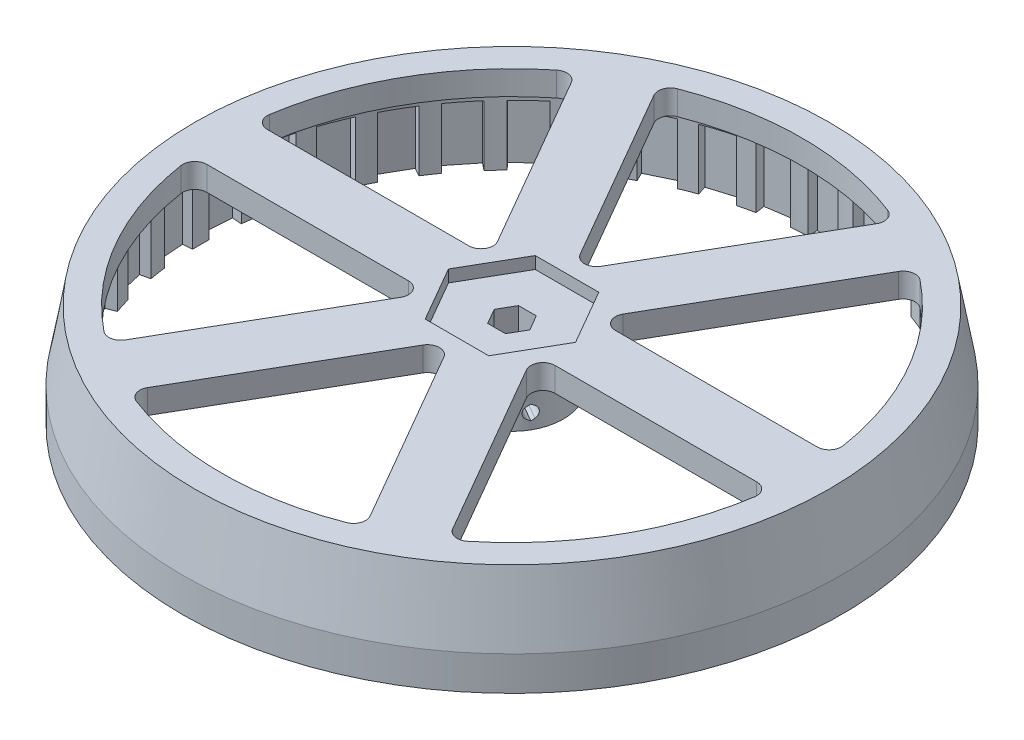
from build123d import *

# Parameters (mm, degrees)
SLOT_CUT_DEPTH                 = 79.92718163
SLOT_CUT_PATTERN_COUNT         = 6
MAGNET_START                   = -10
MAGNET_SLOTS_DEPTH             = 10
MAGNET_CUT_PATTERN_COUNT       = 42
CHAMFER1_SIZE                  = 2
CHAMFER1_SIZE2                 = 11.342563639
CUT_EXTRUDE1_DEPTH             = 79.92718163
CUT_EXTRUDE1_DEPTH_BACK        = 79.92718163
SKETCH8_R                      = 8.5
BOSS_EXTRUDE1_DEPTH            = 8
SKETCH9_R                      = 9
SKETCH9_R_2                    = 8.5
BOSS_EXTRUDE2_DEPTH            = 1
CUT_EXTRUDE2_DEPTH             = 1
CUT_EXTRUDE2_DEPTH_BACK        = 1.5
SKETCH10_W                     = 4
SKETCH10_H                     = 5
CUT_EXTRUDE3_DEPTH             = 1.5
CUT_EXTRUDE3_DEPTH_BACK        = 1.5
CUT_EXTRUDE3_START             = 5.1
SKETCH10_2_W                   = 4
SKETCH10_2_H                   = 5
FILLET1_R                      = 0.5
CUT_EXTRUDE4_REACH             = 89.458
CUT_EXTRUDE4_DIRECTION_2_DEPTH = 15.5
CUT_EXTRUDE6_DEPTH             = 2


with BuildPart() as part:
    # Sketch1 → Main Revolve (revolve)
    with BuildSketch(Plane.XY, mode=Mode.PRIVATE) as main_revolve_sk:
        Polygon((0, 29), (0, 33), (54.5, 33), (54.5, 16), (51.5, 16), (51.5, 29), align=None)
    revolve(main_revolve_sk.sketch.rotate(Axis((0, 0, 0), (0, 1, 0)), 90), axis=Axis((0, 0, 0), (0, 1, 0)))

    # Sketch2 → Slot Cut (cut, through all)
    with BuildSketch(Plane(origin=(0, 33, 0), x_dir=(1, 0, 0), z_dir=(0, 1, 0))):
        with BuildLine():
            Line((18.402008824, 41.873214245), (1.732050808, 13))
            ThreePointArc((1.732050808, 13), (0, 12), (-1.732050808, 13))
            Line((-1.732050808, 13), (-18.402008824, 41.873214245))
            ThreePointArc((-18.402008824, 41.873214245), (-18.556676058, 43.536761555), (-17.3947388, 44.737267038))
            ThreePointArc((-17.3947388, 44.737267038), (0, 48), (17.3947388, 44.737267038))
            ThreePointArc((17.3947388, 44.737267038), (18.556676058, 43.536761555), (18.402008824, 41.873214245))
        make_face()
    slot_cut = extrude(amount=-SLOT_CUT_DEPTH, mode=Mode.SUBTRACT)

    # Slot Cut Pattern: Slot Cut ×6 about axis
    slot_cut_pattern_axis = Axis((0, 0, 0), (0, 1, 0))
    for i in range(1, SLOT_CUT_PATTERN_COUNT):
        add(slot_cut.rotate(slot_cut_pattern_axis, i * 360 / SLOT_CUT_PATTERN_COUNT), mode=Mode.SUBTRACT)

    # Sketch4 → Magnet Slots (cut)
    with BuildSketch(Plane.XZ.offset(-16).offset(MAGNET_START)):
        with BuildLine():
            Line((-2.5, 53), (2.5, 53))
            Line((2.5, 53), (2.5, 51.439284598))
            ThreePointArc((2.5, 51.439284598), (0, 51.5), (-2.5, 51.439284598))
            Line((-2.5, 51.439284598), (-2.5, 53))
        make_face()
    magnet_slots = extrude(amount=MAGNET_SLOTS_DEPTH, mode=Mode.SUBTRACT)

    # Magnet Cut Pattern: Magnet Slots ×42 about axis
    magnet_cut_pattern_axis = Axis((0, 0, 0), (0, 1, 0))
    for i in range(1, MAGNET_CUT_PATTERN_COUNT):
        add(magnet_slots.rotate(magnet_cut_pattern_axis, i * 360 / MAGNET_CUT_PATTERN_COUNT), mode=Mode.SUBTRACT)

    # Chamfer1
    chamfer1_edges = [part.edges().sort_by_distance(p)[0] for p in [
        (0, 33, 54.5),
    ]]
    chamfer1_side = [part.faces().sort_by_distance(p)[0] for p in [
        (0, 33, 0),
    ]]
    chamfer(chamfer1_edges, length=CHAMFER1_SIZE, length2=CHAMFER1_SIZE2, reference=chamfer1_side[0])

    # Sketch5 → Cut-Extrude1 (cut, two sides: drawn at the far end of the back side and taken through both)
    with BuildSketch(Plane(origin=(0, 33, 0), x_dir=(1, 0, 0), z_dir=(0, 1, 0)).offset(-CUT_EXTRUDE1_DEPTH_BACK)):
        Polygon((2.944486373, 0), (1.472243186, 2.55), (-1.472243186, 2.55), (-2.944486373, 0), (-1.472243186, -2.55), (1.472243186, -2.55), align=None)
    extrude(amount=CUT_EXTRUDE1_DEPTH + CUT_EXTRUDE1_DEPTH_BACK, mode=Mode.SUBTRACT)

    # Sketch8 → Boss-Extrude1 (add)
    with BuildSketch(Plane.XZ.offset(-29)):
        with Locations(Location((0, 0, 0), (0, 0, 270))):
            Circle(SKETCH8_R)
        Polygon((2.944486373, 0), (1.472243186, 2.55), (-1.472243186, 2.55), (-2.944486373, 0), (-1.472243186, -2.55), (1.472243186, -2.55), align=None, mode=Mode.SUBTRACT)
    extrude(amount=BOSS_EXTRUDE1_DEPTH)

    # Sketch9 → Boss-Extrude2 (add)
    with BuildSketch(Plane.XZ.offset(-29)):
        with Locations(Location((0, 0, 0), (0, 0, 270))):
            Circle(SKETCH9_R)
        with Locations(Location((0, 0, 0), (0, 0, 270))):
            Circle(SKETCH9_R_2, mode=Mode.SUBTRACT)
    extrude(amount=BOSS_EXTRUDE2_DEPTH)

    # Sketch10 → Cut-Extrude2 (cut, two sides: drawn at the far end of the back side and taken through both)
    with BuildSketch(Plane(origin=(-2.20836478, 0, -1.275), x_dir=(0.4999999999999999, 0, -0.8660254037844387), z_dir=(0.8660254037844388, 0, 0.49999999999999994)).offset(-CUT_EXTRUDE2_DEPTH_BACK)):
        with Locations((0, 23.5)):
            Rectangle(SKETCH10_W, SKETCH10_H)
    extrude(amount=CUT_EXTRUDE2_DEPTH + CUT_EXTRUDE2_DEPTH_BACK, mode=Mode.SUBTRACT)

    # Sketch10<2> → Cut-Extrude3 (cut, two sides: drawn at the far end of the back side and taken through both)
    with BuildSketch(Plane(origin=(-2.20836478, 0, -1.275), x_dir=(0.4999999999999999, 0, -0.8660254037844387), z_dir=(0.8660254037844388, 0, 0.49999999999999994)).offset(CUT_EXTRUDE3_START - CUT_EXTRUDE3_DEPTH_BACK)):
        with Locations((0, 23.5)):
            Rectangle(SKETCH10_2_W, SKETCH10_2_H)
    extrude(amount=CUT_EXTRUDE3_DEPTH + CUT_EXTRUDE3_DEPTH_BACK, mode=Mode.SUBTRACT)

    # Fillet1
    fillet1_edges = [part.edges().sort_by_distance(p)[0] for p in [
        (-2.416729559, 23.5, 0.914101615),
        (-0.416729559, 23.5, -2.55),
        (2.416729559, 23.5, -0.914101615),
        (0.416729559, 23.5, 2.55),
    ]]
    fillet(fillet1_edges, radius=FILLET1_R)

    # Sketch11 → Cut-Extrude4 (cut, up to next)
    with BuildSketch(Plane(origin=(-3.507402885, 0, -2.025), x_dir=(0.4999999999999997, 0, -0.8660254037844388), z_dir=(0.8660254037844389, 0, 0.49999999999999983)), mode=Mode.PRIVATE) as cut_extrude4_sk1:
        with BuildLine():
            Line((0, 22.3), (-0.508329064, 22.58125))
            ThreePointArc((-0.508329064, 22.58125), (-1.05, 23.5), (-0.508329064, 24.41875))
            Line((-0.508329064, 24.41875), (0, 24.7))
            Line((0, 24.7), (0.508329064, 24.41875))
            ThreePointArc((0.508329064, 24.41875), (1.05, 23.5), (0.508329064, 22.58125))
            Line((0.508329064, 22.58125), (0, 22.3))
        make_face()
    cut_extrude4_tool1 = extrude(cut_extrude4_sk1.sketch, amount=-CUT_EXTRUDE4_REACH, mode=Mode.PRIVATE) & part.part
    add(cut_extrude4_tool1.solids().sort_by_distance((-3.507403, 23.5, -2.025))[0], mode=Mode.SUBTRACT)

    # Sketch11 → Cut-Extrude4 direction 2 (cut)
    with BuildSketch(Plane(origin=(-3.507402885, 0, -2.025), x_dir=(0.4999999999999997, 0, -0.8660254037844388), z_dir=(0.8660254037844389, 0, 0.49999999999999983))):
        with BuildLine():
            Line((0, 22.3), (-0.508329064, 22.58125))
            ThreePointArc((-0.508329064, 22.58125), (-1.05, 23.5), (-0.508329064, 24.41875))
            Line((-0.508329064, 24.41875), (0, 24.7))
            Line((0, 24.7), (0.508329064, 24.41875))
            ThreePointArc((0.508329064, 24.41875), (1.05, 23.5), (0.508329064, 22.58125))
            Line((0.508329064, 22.58125), (0, 22.3))
        make_face()
    extrude(amount=CUT_EXTRUDE4_DIRECTION_2_DEPTH, mode=Mode.SUBTRACT)

    # Sketch14 → Cut-Extrude6 (cut)
    with BuildSketch(Plane(origin=(0, 33, 0), x_dir=(1, 0, 0), z_dir=(0, 1, 0))):
        Polygon((5.25388745, -9.1), (10.507774899, 0), (5.25388745, 9.1), (-5.25388745, 9.1), (-10.507774899, 0), (-5.25388745, -9.1), align=None)
    extrude(amount=-CUT_EXTRUDE6_DEPTH, mode=Mode.SUBTRACT)


solid = part.part
